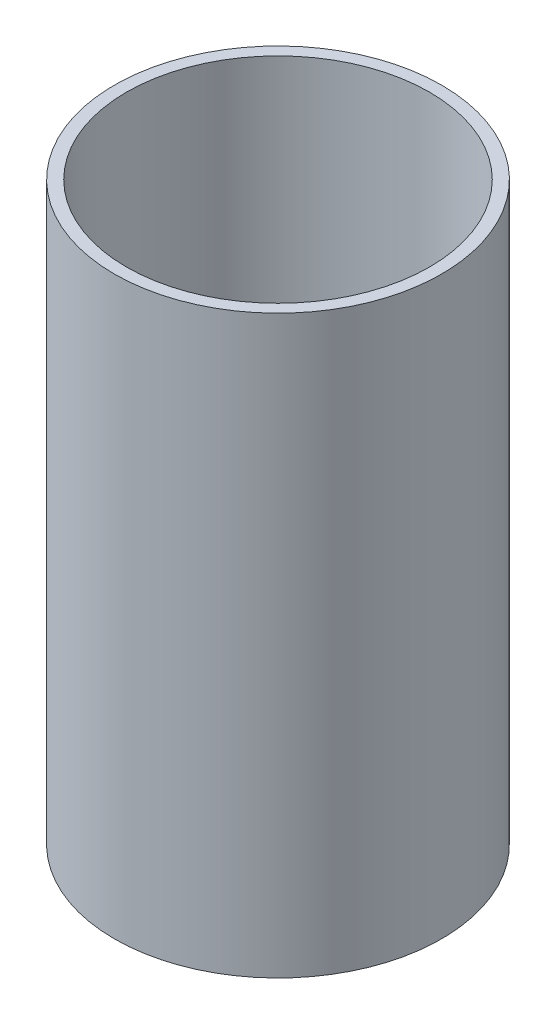
from build123d import *

# Parameters (mm, degrees)
SKETCH2_R           = 13.716
SKETCH2_R_2         = 12.7
BOSS_EXTRUDE1_DEPTH = 48.26


with BuildPart() as part:
    # Sketch2 → Boss-Extrude1 (new body)
    with BuildSketch(Plane(origin=(0, 0, 0), x_dir=(1, 0, 0), z_dir=(0, 1, 0))):
        with Locations(Location((0, 0, 0), (0, 0, 90))):
            Circle(SKETCH2_R)
        with Locations(Location((0, 0, 0), (0, 0, 90))):
            Circle(SKETCH2_R_2, mode=Mode.SUBTRACT)
    extrude(amount=BOSS_EXTRUDE1_DEPTH)


solid = part.part
